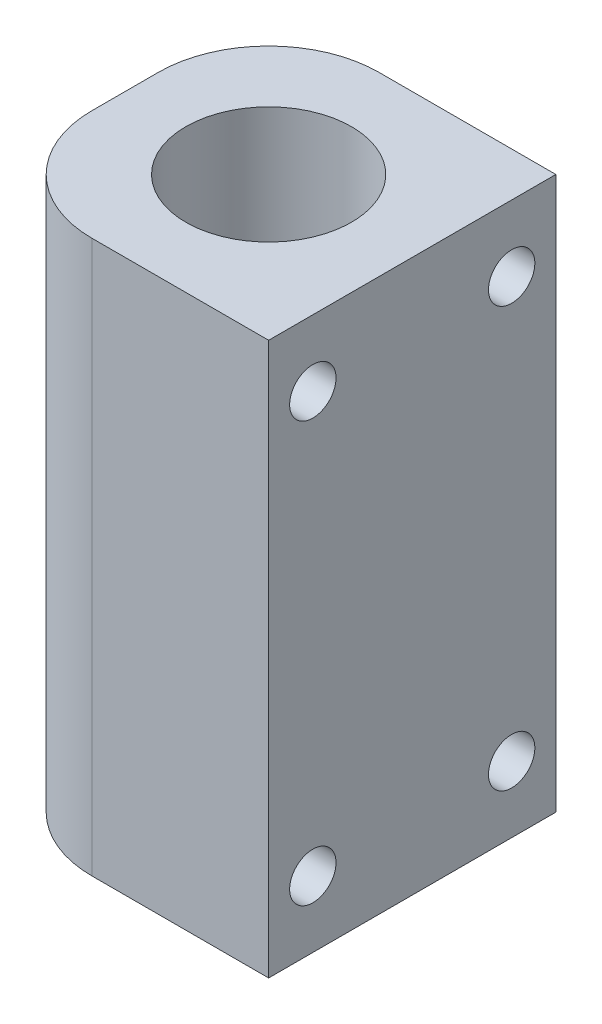
from build123d import *

# Parameters (mm, degrees)
SKIZZE1_W                       = 26
SKIZZE1_H                       = 50
AUFSATZ_LINEAR_AUSTRAGEN1_DEPTH = 26
VERRUNDUNG1_R                   = 10
SKIZZE2_R                       = 7.5
SCHNITT_LINEAR_AUSTRAGEN1_DEPTH = 58.835974964
M5_GEWINDEBOHRUNG1_D            = 4.2
M5_GEWINDEBOHRUNG1_DEPTH        = 9
M5_GEWINDEBOHRUNG1_TIP          = 1.2618073


with BuildPart() as part:
    # Skizze1 → Aufsatz-Linear austragen1 (new body)
    with BuildSketch(Plane.XY):
        Rectangle(SKIZZE1_W, SKIZZE1_H)
    extrude(amount=AUFSATZ_LINEAR_AUSTRAGEN1_DEPTH)

    # Verrundung1
    verrundung1_edges = [part.edges().sort_by_distance(p)[0] for p in [
        (-13, 0, 26),
        (-13, 0, 0),
    ]]
    fillet(verrundung1_edges, radius=VERRUNDUNG1_R)

    # Skizze2 → Schnitt-Linear austragen1 (cut, through all)
    with BuildSketch(Plane(origin=(0, 25, 0), x_dir=(1, 0, 0), z_dir=(0, 1, 0))):
        with Locations(Location((0, -13, 0), (0, 0, 180))):
            Circle(SKIZZE2_R)
    extrude(amount=-SCHNITT_LINEAR_AUSTRAGEN1_DEPTH, mode=Mode.SUBTRACT)

    # M5 Gewindebohrung1
    with Locations(Plane(origin=(13, 0, 0), x_dir=(0, 0, -1), z_dir=(1, 0, 0))):
        with Locations((-22, 19), (-4, 19), (-22, -19), (-4, -19)):
            Hole(M5_GEWINDEBOHRUNG1_D / 2, depth=M5_GEWINDEBOHRUNG1_DEPTH)
            with Locations((0, 0, -(M5_GEWINDEBOHRUNG1_DEPTH + M5_GEWINDEBOHRUNG1_TIP / 2))):  # 118° drill point
                Cone(0, M5_GEWINDEBOHRUNG1_D / 2, M5_GEWINDEBOHRUNG1_TIP, mode=Mode.SUBTRACT)


solid = part.part
